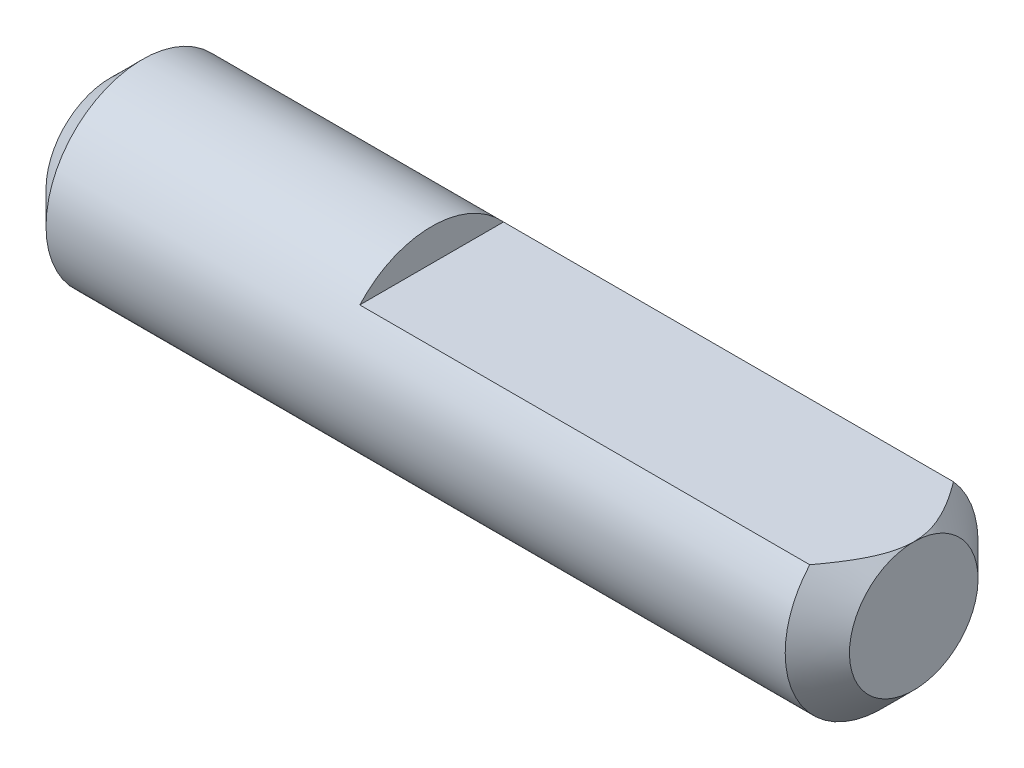
from build123d import *
from build123d.topology import SkipClean

# Parameters (mm, degrees)
SKETCH1_W               = 25
SKETCH1_H               = 3
CHAMFER1_SIZE           = 1
CUT_EXTRUDE1_DEPTH      = 14.200378782
CUT_EXTRUDE1_DEPTH_BACK = 14.200378782
SKETCH2_W               = 15
SKETCH2_H               = 1


with BuildPart() as part:
    # Sketch1 → Revolve1 (revolve)
    with BuildSketch(Plane.XY, mode=Mode.PRIVATE) as revolve1_sk:
        with Locations((0, 1.5)):
            Rectangle(SKETCH1_W, SKETCH1_H)
    revolve(revolve1_sk.sketch.rotate(Axis((-12.5, 0, 0), (1, 0, 0)), 90), axis=Axis((-12.5, 0, 0), (1, 0, 0)))

    # Chamfer1
    chamfer1_edges = [part.edges().sort_by_distance(p)[0] for p in [
        (-12.5, 0, -3),
        (12.5, 0, -3),
    ]]
    chamfer(chamfer1_edges, length=CHAMFER1_SIZE)

    # Sketch2 → Cut-Extrude1 (cut, two sides: drawn at the far end of the back side and taken through both)
    with SkipClean():  # the faces are left unmerged after this step: merging them gives an invalid solid
        with BuildSketch(Plane.XY.offset(-CUT_EXTRUDE1_DEPTH_BACK)):
            with Locations((5, 2.5)):
                Rectangle(SKETCH2_W, SKETCH2_H)
        extrude(amount=CUT_EXTRUDE1_DEPTH + CUT_EXTRUDE1_DEPTH_BACK, mode=Mode.SUBTRACT)


solid = part.part
